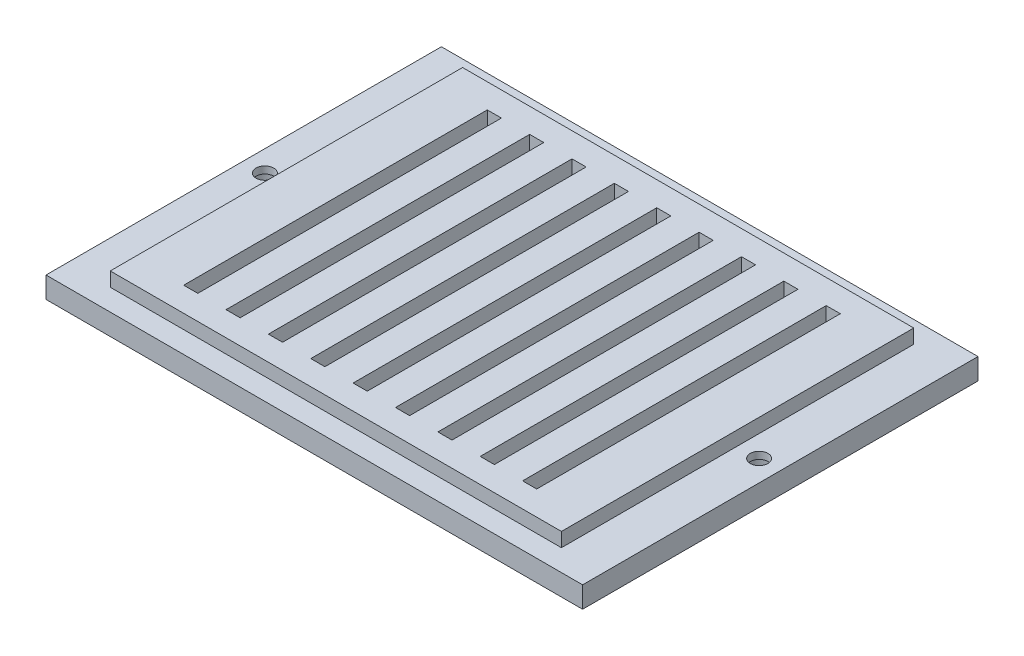
from build123d import *

# Parameters (mm, degrees)
SKETCH1_W           = 76
SKETCH1_H           = 56
BOSS_EXTRUDE1_DEPTH = 3
SKETCH2_W           = 63.9
SKETCH2_H           = 49.9
BOSS_EXTRUDE2_DEPTH = 2
SKETCH3_R           = 2.25
CUT_EXTRUDE1_DEPTH  = 2
CUT_EXTRUDE2_REACH  = 49.466
SKETCH4_R           = 1.25
SKETCH5_W           = 2
SKETCH5_H           = 43
CUT_EXTRUDE3_DEPTH  = 48.465777145


with BuildPart() as part:
    # Sketch1 → Boss-Extrude1 (new body)
    with BuildSketch(Plane(origin=(0, 0, 0), x_dir=(1, 0, 0), z_dir=(0, 1, 0))):
        Rectangle(SKETCH1_W, SKETCH1_H)
    extrude(amount=BOSS_EXTRUDE1_DEPTH)

    # Sketch2 → Boss-Extrude2 (add)
    with BuildSketch(Plane(origin=(0, 3, 0), x_dir=(1, 0, 0), z_dir=(0, 1, 0))):
        Rectangle(SKETCH2_W, SKETCH2_H)
    extrude(amount=BOSS_EXTRUDE2_DEPTH)

    # Sketch3 → Cut-Extrude1 (cut)
    with BuildSketch(Plane.XZ):
        with Locations(Location((-35, 0, 0), (0, 0, 270))):
            Circle(SKETCH3_R)
        with Locations(Location((35, 0, 0), (0, 0, 90))):
            Circle(SKETCH3_R)
    extrude(amount=-CUT_EXTRUDE1_DEPTH, mode=Mode.SUBTRACT)

    # Sketch4 → Cut-Extrude2 (cut, up to next)
    with BuildSketch(Plane.XZ, mode=Mode.PRIVATE) as cut_extrude2_sk1:
        with Locations(Location((-35, 0, 0), (0, 0, 270))):
            Circle(SKETCH4_R)
    cut_extrude2_tool1 = extrude(cut_extrude2_sk1.sketch, amount=-CUT_EXTRUDE2_REACH, mode=Mode.PRIVATE) & part.part
    # Sketch4 → Cut-Extrude2 (cut, up to next)
    with BuildSketch(Plane.XZ, mode=Mode.PRIVATE) as cut_extrude2_sk2:
        with Locations(Location((35, 0, 0), (0, 0, 270))):
            Circle(SKETCH4_R)
    cut_extrude2_tool2 = extrude(cut_extrude2_sk2.sketch, amount=-CUT_EXTRUDE2_REACH, mode=Mode.PRIVATE) & part.part
    add(cut_extrude2_tool1.solids().sort_by_distance((-35, 0, 0))[0], mode=Mode.SUBTRACT)
    add(cut_extrude2_tool2.solids().sort_by_distance((35, 0, 0))[0], mode=Mode.SUBTRACT)

    # Sketch5 → Cut-Extrude3 (cut, through all)
    with BuildSketch(Plane.XZ):
        with Locations((6, 0)):
            Rectangle(SKETCH5_W, SKETCH5_H)
        Rectangle(SKETCH5_W, SKETCH5_H)
        with Locations((12, 0)):
            Rectangle(SKETCH5_W, SKETCH5_H)
        with Locations((18, 0)):
            Rectangle(SKETCH5_W, SKETCH5_H)
        with Locations((24, 0)):
            Rectangle(SKETCH5_W, SKETCH5_H)
        with Locations((-6, 0)):
            Rectangle(SKETCH5_W, SKETCH5_H)
        with Locations((-12, 0)):
            Rectangle(SKETCH5_W, SKETCH5_H)
        with Locations((-18, 0)):
            Rectangle(SKETCH5_W, SKETCH5_H)
        with Locations((-24, 0)):
            Rectangle(SKETCH5_W, SKETCH5_H)
    extrude(amount=-CUT_EXTRUDE3_DEPTH, mode=Mode.SUBTRACT)


solid = part.part
